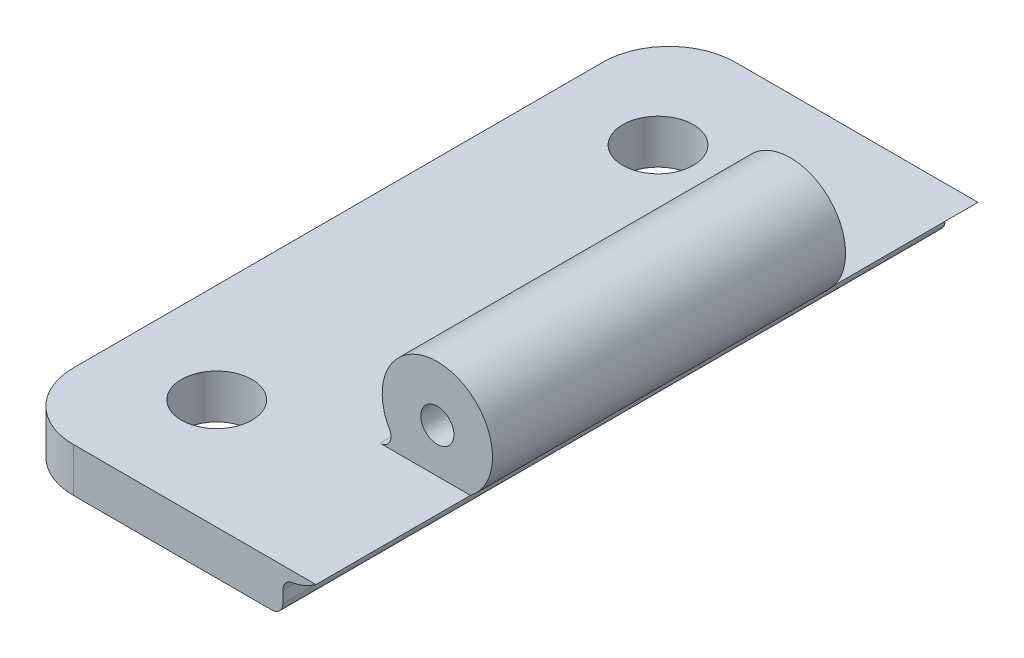
from build123d import *

# Parameters (mm, degrees)
SKETCH_1_R          = 1.6
EXTRUDE_1_DEPTH     = 2
SKETCH_2_R          = 2.5
EXTRUDE_2_DEPTH     = 30
FILLET_1_R          = 0.5
SKETCH_3_R          = 0.75
CUT_EXTRUDE_1_DEPTH = 35.165040612
SKETCH_4_W          = 5.098076211
SKETCH_4_H          = 7
CUT_EXTRUDE_2_DEPTH = 34.841542518


with BuildPart() as part:
    # 草图1 → 凸台-拉伸1 (new body)
    with BuildSketch(Plane(origin=(0, 0, 0), x_dir=(1, 0, 0), z_dir=(0, 1, 0))):
        with BuildLine():
            Line((3, 0), (12.5, 0))
            Line((12.5, 0), (12.5, -30))
            Line((12.5, -30), (3, -30))
            ThreePointArc((3, -30), (0.878679656, -29.121320344), (0, -27))
            Line((0, -27), (0, -3))
            ThreePointArc((0, -3), (0.878679656, -0.878679656), (3, 0))
        make_face()
        with Locations(Location((4.5, -5, 0), (0, 0, 270))):
            Circle(SKETCH_1_R, mode=Mode.SUBTRACT)
        with Locations(Location((4.5, -25, 0), (0, 0, 270))):
            Circle(SKETCH_1_R, mode=Mode.SUBTRACT)
    extrude(amount=EXTRUDE_1_DEPTH)

    # 草图2 → 凸台-拉伸2 (add)
    with BuildSketch(Plane.XY.offset(30)):
        with Locations((12.5, 4)):
            Circle(SKETCH_2_R)
    extrude(amount=-EXTRUDE_2_DEPTH)

    # 圆角1
    fillet_1_edges = [part.edges().sort_by_distance(p)[0] for p in [
        (12.5, 1.5, 15),
        (11, 2, 15),
        (12.5, 0, 15),
    ]]
    fillet(fillet_1_edges, radius=FILLET_1_R)

    # 草图3 → 切除-拉伸1 (cut, through all)
    with BuildSketch(Plane.XY.offset(30)):
        with Locations((12.5, 4)):
            Circle(SKETCH_3_R)
    extrude(amount=-CUT_EXTRUDE_1_DEPTH, mode=Mode.SUBTRACT)

    # 草图4 → 切除-拉伸2 (cut, through all)
    with BuildSketch(Plane(origin=(0, 2, 0), x_dir=(1, 0, 0), z_dir=(0, 1, 0))):
        with Locations((12.450961895, -3.5)):
            Rectangle(SKETCH_4_W, SKETCH_4_H)
        with Locations((12.450961895, -26.5)):
            Rectangle(SKETCH_4_W, SKETCH_4_H)
    extrude(amount=CUT_EXTRUDE_2_DEPTH, mode=Mode.SUBTRACT)


solid = part.part
